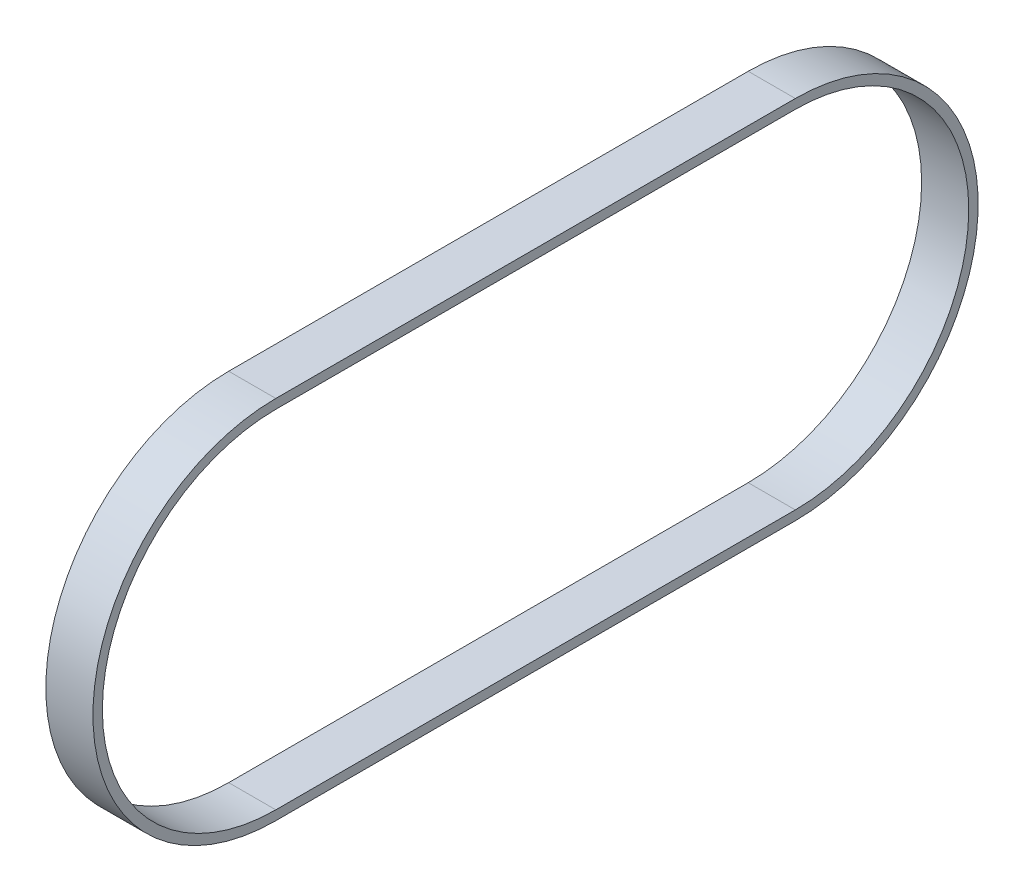
from build123d import *

# Parameters (mm, degrees)
BOSS_EXTRUDE1_DEPTH = 3.175


with BuildPart() as part:
    # Sketch1 → Boss-Extrude1 (new body)
    with BuildSketch(Plane(origin=(0, 0, 0), x_dir=(0, 0, -1), z_dir=(1, 0, 0))):
        with BuildLine():
            Line((0, -12.319), (35, -12.319))
            ThreePointArc((35, -12.319), (47.319, 0), (35, 12.319))
            Line((35, 12.319), (0, 12.319))
            ThreePointArc((0, 12.319), (-12.319, 0), (0, -12.319))
        make_face()
        with BuildLine():
            Line((0, 11.684), (35, 11.684))
            ThreePointArc((35, 11.684), (46.684, 0), (35, -11.684))
            Line((35, -11.684), (0, -11.684))
            ThreePointArc((0, -11.684), (-11.684, 0), (0, 11.684))
        make_face(mode=Mode.SUBTRACT)
    extrude(amount=BOSS_EXTRUDE1_DEPTH)


solid = part.part
